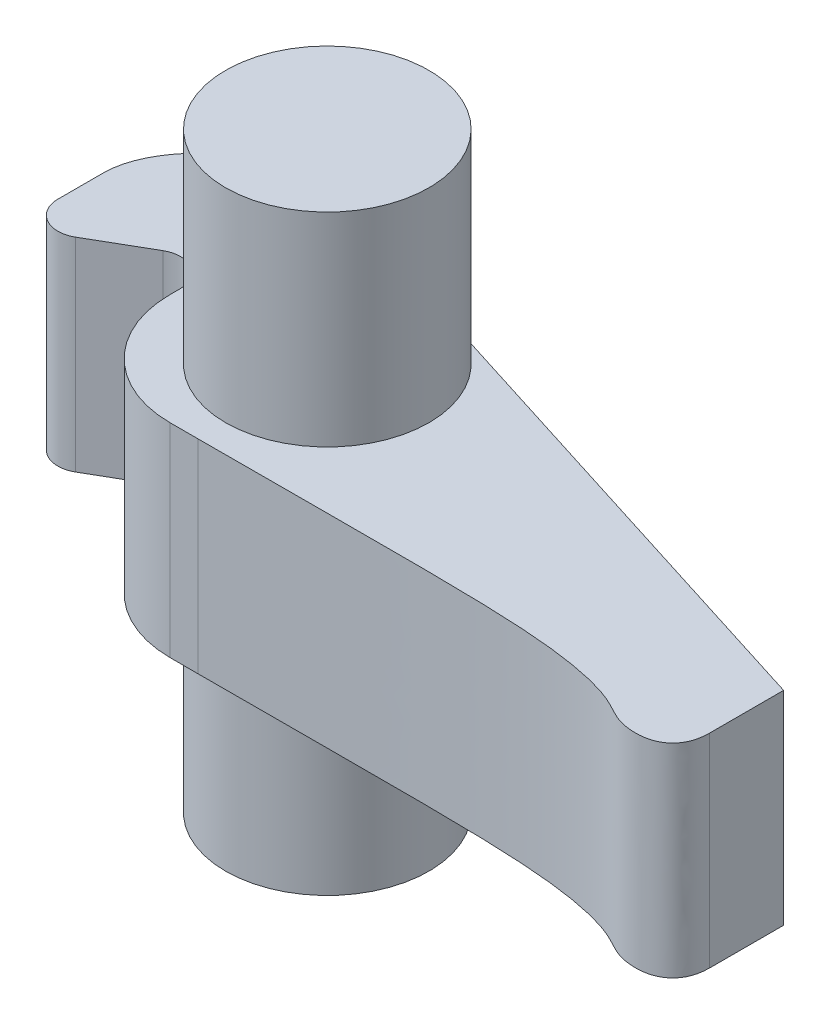
from build123d import *

# Parameters (mm, degrees)
BOSS_EXTRUDE1_DEPTH      = 2.2
BOSS_EXTRUDE2_DEPTH      = 4.4
BOSS_EXTRUDE2_DEPTH_BACK = 2
SKETCH1_3_R              = 1.1


with BuildPart() as part:
    # Sketch1 → Boss-Extrude1 (new body)
    with BuildSketch(Plane(origin=(0, 0, 0), x_dir=(1, 0, 0), z_dir=(0, 1, 0))):
        with BuildLine():
            Line((5.523587939, -1.389168628), (5.523587939, -0.589168628))
            Line((5.523587939, -0.589168628), (0.373516405, 1.03464269))
            ThreePointArc((0.373516405, 1.03464269), (0.330776379, 1.049088646), (0.28747994, 1.061769883))
            Line((0.28747994, 1.061769883), (-1.533917496, 1.636054289))
            add(Edge.make_bspline(
                [(-3, 0.587196294), (-2.993093164, 1.205023593), (-2.177968287, 1.839122723), (-1.533917496, 1.636054289)],
                knots=[0, 0, 0, 0, 1, 1, 1, 1], degree=3))
            Line((-3, 0.587196294), (-3, 0.08639369))
            ThreePointArc((-3, 0.08639369), (-2.85, -0.173413931), (-2.55, -0.173413931))
            Line((-2.55, -0.173413931), (-1.95, 0.17299623))
            ThreePointArc((-1.95, 0.17299623), (-1.65, 0.17299623), (-1.5, -0.086811391))
            Line((-1.5, -0.086811391), (-1.5, -0.2))
            ThreePointArc((-1.5, -0.2), (-1.148528137, -1.048528137), (-0.3, -1.4))
            Line((-0.3, -1.4), (0, -1.4))
            add(Edge.make_bspline(
                [(5.523587939, -1.389168628), (5.523587939, -1.655644582), (5.31087633, -1.80182616), (4.791580785, -1.773367747), (4.77273176, -1.59674075), (3.415135688, -1.368008507), (2.1, -1.4), (0, -1.4)],
                knots=[0, 0, 0, 0, 0.200930821, 0.262112326, 0.572959193, 0.650633546, 1, 1, 1, 1], degree=3))
        make_face()
    extrude(amount=BOSS_EXTRUDE1_DEPTH)

    # Sketch1<3> → Boss-Extrude2 (add, two sides: drawn at the far end of the back side and taken through both)
    with BuildSketch(Plane(origin=(0, 0, 0), x_dir=(1, 0, 0), z_dir=(0, 1, 0)).offset(-BOSS_EXTRUDE2_DEPTH_BACK)):
        with Locations(Location((0, 0, 0), (0, 0, 270))):
            Circle(SKETCH1_3_R)
    extrude(amount=BOSS_EXTRUDE2_DEPTH + BOSS_EXTRUDE2_DEPTH_BACK)


solid = part.part
